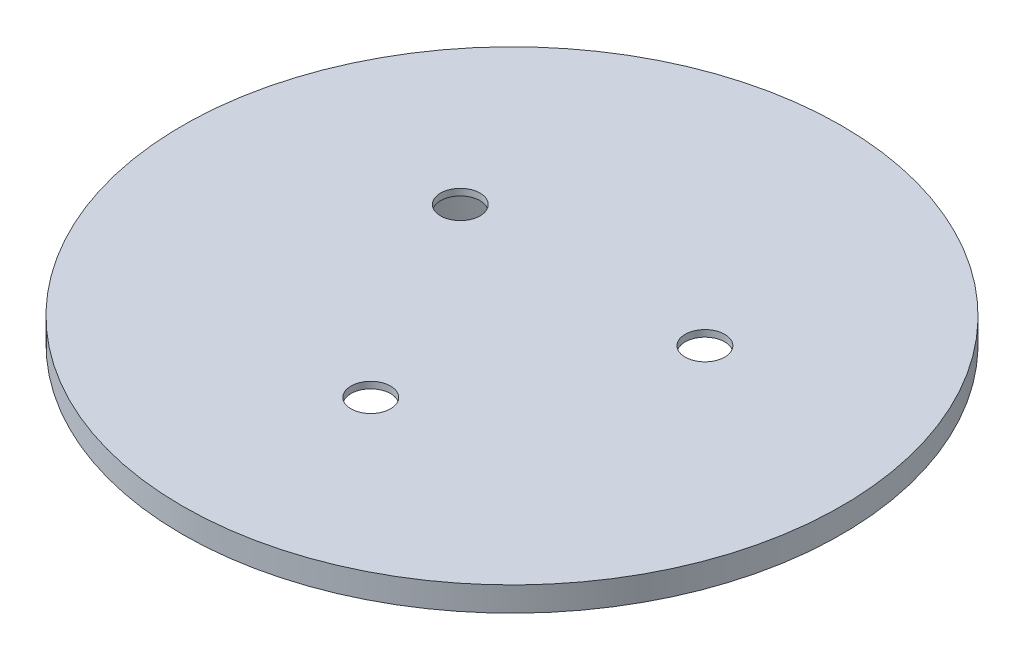
from build123d import *

# Parameters (mm, degrees)
SKETCH1_R           = 24.8
BOSS_EXTRUDE1_DEPTH = 3.1
SKETCH2_R           = 35
BOSS_EXTRUDE2_DEPTH = 2.6
SKETCH3_R           = 20.05
CUT_EXTRUDE1_DEPTH  = 5
CUT_EXTRUDE2_REACH  = 51.749
SKETCH4_R           = 2.1


with BuildPart() as part:
    # Sketch1 → Boss-Extrude1 (new body)
    with BuildSketch(Plane(origin=(0, 0, 0), x_dir=(1, 0, 0), z_dir=(0, 1, 0))):
        with Locations(Location((0, 0, 0), (0, 0, 90))):
            Circle(SKETCH1_R)
    extrude(amount=BOSS_EXTRUDE1_DEPTH)

    # Sketch2 → Boss-Extrude2 (add)
    with BuildSketch(Plane(origin=(0, 3.1, 0), x_dir=(1, 0, 0), z_dir=(0, 1, 0))):
        with Locations(Location((0, 0, 0), (0, 0, 270))):
            Circle(SKETCH2_R)
    extrude(amount=BOSS_EXTRUDE2_DEPTH)

    # Sketch3 → Cut-Extrude1 (cut)
    with BuildSketch(Plane.XZ):
        with Locations(Location((0, 0, 0), (0, 0, 270))):
            Circle(SKETCH3_R)
    extrude(amount=-CUT_EXTRUDE1_DEPTH, mode=Mode.SUBTRACT)

    # Sketch4 → Cut-Extrude2 (cut, up to next)
    with BuildSketch(Plane.XZ.offset(-5), mode=Mode.PRIVATE) as cut_extrude2_sk1:
        with Locations(Location((0, 15, 0), (0, 0, 270))):
            Circle(SKETCH4_R)
    cut_extrude2_tool1 = extrude(cut_extrude2_sk1.sketch, amount=-CUT_EXTRUDE2_REACH, mode=Mode.PRIVATE) & part.part
    # Sketch4 → Cut-Extrude2 (cut, up to next)
    with BuildSketch(Plane.XZ.offset(-5), mode=Mode.PRIVATE) as cut_extrude2_sk2:
        with Locations(Location((-12.990381057, -7.5, 0), (0, 0, 270))):
            Circle(SKETCH4_R)
    cut_extrude2_tool2 = extrude(cut_extrude2_sk2.sketch, amount=-CUT_EXTRUDE2_REACH, mode=Mode.PRIVATE) & part.part
    # Sketch4 → Cut-Extrude2 (cut, up to next)
    with BuildSketch(Plane.XZ.offset(-5), mode=Mode.PRIVATE) as cut_extrude2_sk3:
        with Locations(Location((12.990381057, -7.5, 0), (0, 0, 270))):
            Circle(SKETCH4_R)
    cut_extrude2_tool3 = extrude(cut_extrude2_sk3.sketch, amount=-CUT_EXTRUDE2_REACH, mode=Mode.PRIVATE) & part.part
    add(cut_extrude2_tool1.solids().sort_by_distance((0, 5, 15))[0], mode=Mode.SUBTRACT)
    add(cut_extrude2_tool2.solids().sort_by_distance((-12.990381, 5, -7.5))[0], mode=Mode.SUBTRACT)
    add(cut_extrude2_tool3.solids().sort_by_distance((12.990381, 5, -7.5))[0], mode=Mode.SUBTRACT)


solid = part.part
